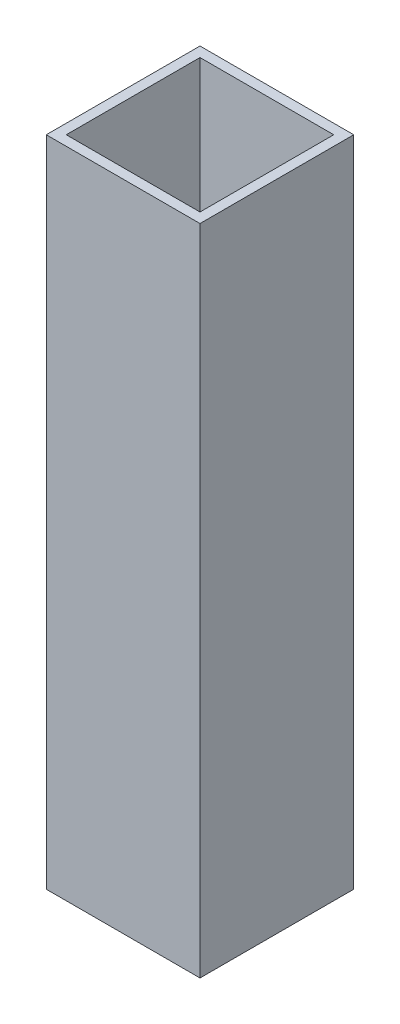
from build123d import *

# Parameters (mm, degrees)
SKETCH1_W           = 25.4
SKETCH1_H           = 25.4
BOSS_EXTRUDE1_DEPTH = 107.95
SKETCH2_W           = 22.098
SKETCH2_H           = 22.098
CUT_EXTRUDE1_DEPTH  = 76.2


with BuildPart() as part:
    # Sketch1 → Boss-Extrude1 (new body)
    with BuildSketch(Plane(origin=(0, 0, 0), x_dir=(1, 0, 0), z_dir=(0, 1, 0))):
        with Locations((12.7, -12.7)):
            Rectangle(SKETCH1_W, SKETCH1_H)
    extrude(amount=BOSS_EXTRUDE1_DEPTH)

    # Sketch2 → Cut-Extrude1 (cut)
    with BuildSketch(Plane(origin=(0, 107.95, 0), x_dir=(1, 0, 0), z_dir=(0, 1, 0))):
        with Locations((12.7, -12.7)):
            Rectangle(SKETCH2_W, SKETCH2_H)
    extrude(amount=-CUT_EXTRUDE1_DEPTH, mode=Mode.SUBTRACT)


solid = part.part
